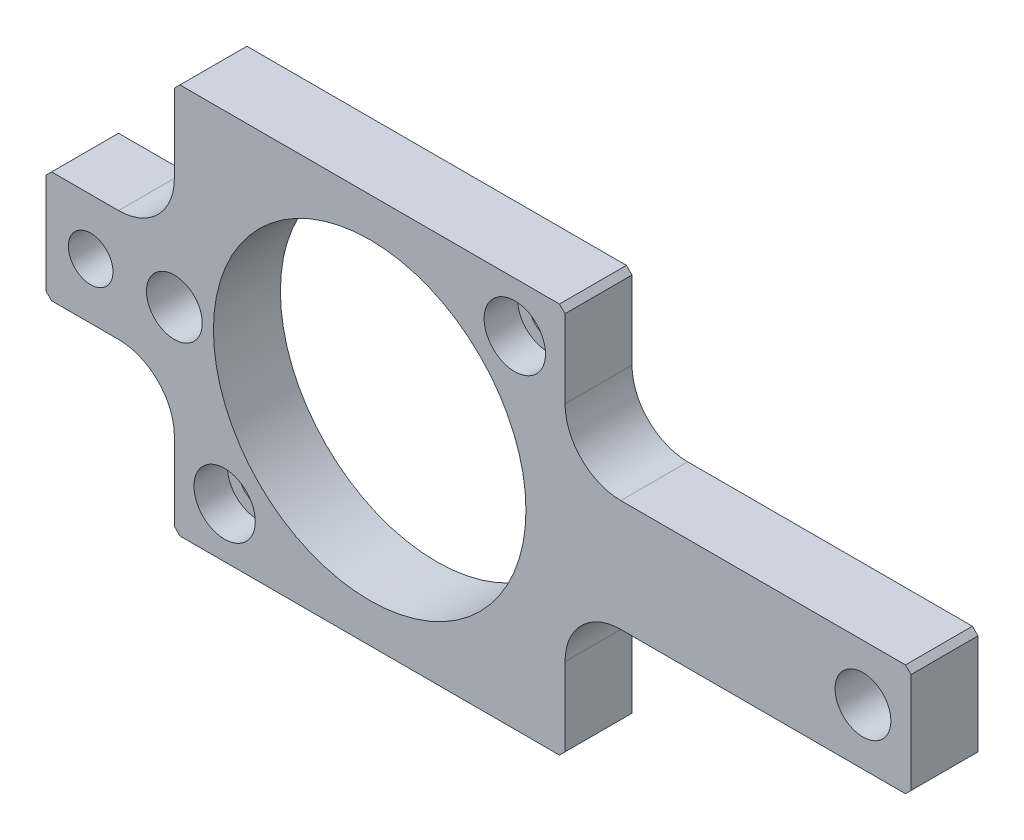
from build123d import *

# Parameters (mm, degrees)
ESQUISSE4_R             = 28
BASE_EXTRUSION_DEPTH    = 12
CHANFREIN2_SIZE         = 1
PER_AGE1_D              = 6.6
PER_AGE1_CBORE_D        = 11
PER_AGE1_CBORE_DEPTH    = 6
ESQUISSE7_R             = 5
ESQUISSE7_R_2           = 4
ENL_V_MAT_EXTRU_1_DEPTH = 150.89329538


with BuildPart() as part:
    # Esquisse4 → Base-Extrusion (new body)
    with BuildSketch(Plane.XY):
        with BuildLine():
            Line((0, 0), (70, 0))
            Line((70, 0), (70, 15))
            ThreePointArc((70, 15), (72.928932188, 22.071067812), (80, 25))
            Line((80, 25), (132, 25))
            Line((132, 25), (132, 45))
            Line((132, 45), (80, 45))
            ThreePointArc((80, 45), (72.928932188, 47.928932188), (70, 55))
            Line((70, 55), (70, 70))
            Line((70, 70), (0, 70))
            Line((0, 70), (0, 55))
            ThreePointArc((0, 55), (-2.928932188, 47.928932188), (-10, 45))
            Line((-10, 45), (-23, 45))
            Line((-23, 45), (-23, 25))
            Line((-23, 25), (-10, 25))
            ThreePointArc((-10, 25), (-2.928932188, 22.071067812), (0, 15))
            Line((0, 15), (0, 0))
        make_face()
        with Locations((35, 35)):
            Circle(ESQUISSE4_R, mode=Mode.SUBTRACT)
    extrude(amount=BASE_EXTRUSION_DEPTH)

    # Chanfrein2
    chanfrein2_edges = [part.edges().sort_by_distance(p)[0] for p in [
        (-23, 45, 6),
        (-23, 25, 6),
        (0, 0, 6),
        (70, 0, 6),
        (132, 25, 6),
        (132, 45, 6),
        (70, 70, 6),
        (0, 70, 6),
    ]]
    chamfer(chanfrein2_edges, length=CHANFREIN2_SIZE)

    # Perçage1 (through all)
    with Locations(Plane.XY.offset(12)):
        with Locations((9, 9), (61, 61)):
            CounterBoreHole(PER_AGE1_D / 2, PER_AGE1_CBORE_D / 2, PER_AGE1_CBORE_DEPTH)

    # Esquisse7 → Enlèv. mat.-Extru.1 (cut, through all)
    with BuildSketch(Plane.XY.offset(12)):
        with Locations((0, 35)):
            Circle(ESQUISSE7_R)
        with Locations((-15, 35)):
            Circle(ESQUISSE7_R_2)
        with Locations((123.39, 35)):
            Circle(ESQUISSE7_R)
    extrude(amount=-ENL_V_MAT_EXTRU_1_DEPTH, mode=Mode.SUBTRACT)


solid = part.part
